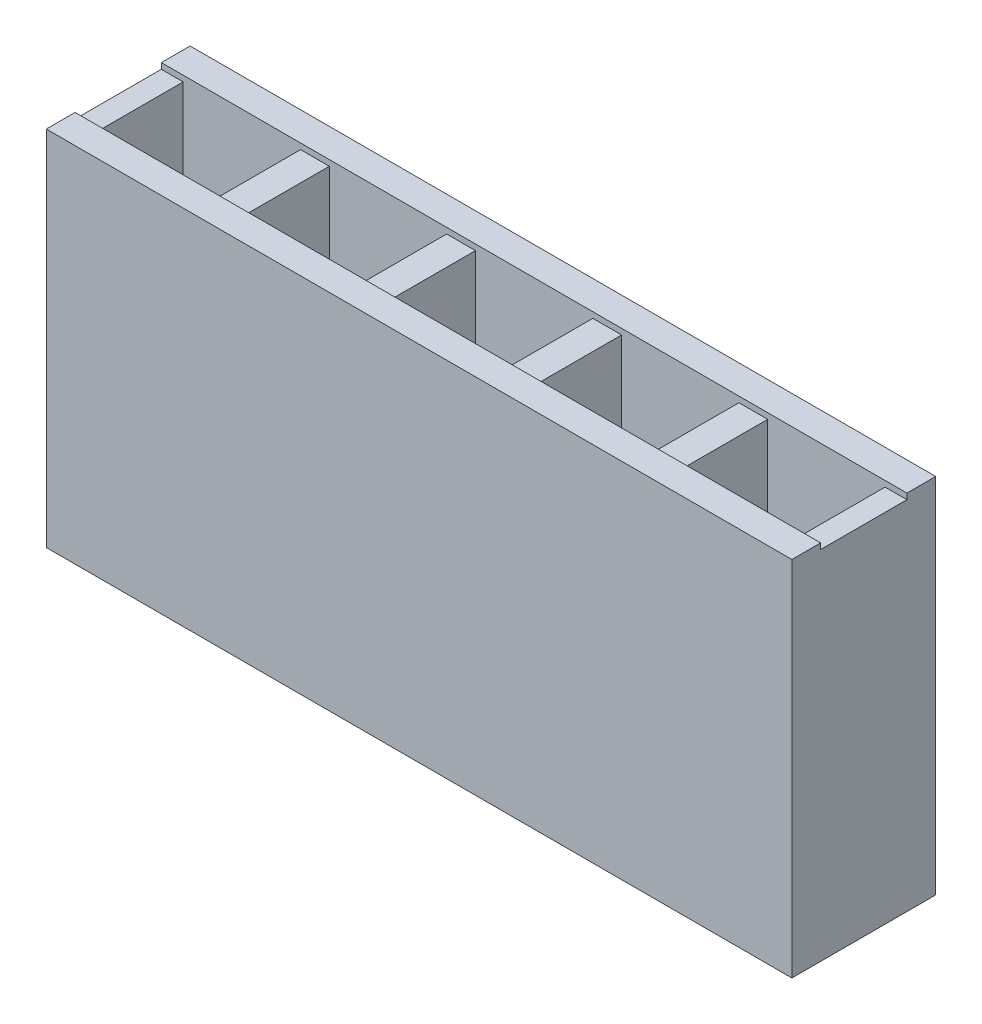
from build123d import *

# Parameters (mm, degrees)
SKETCH1_W                 = 12.96
SKETCH1_H                 = 2.5
BOSS_EXTRUDE1_DEPTH       = 6.2
SKETCH2_W                 = 2.04
SKETCH2_H                 = 1.5
CUT_EXTRUDE1_DEPTH        = 5.75
SKETCH3_W                 = 1.6
SKETCH3_H                 = 1.6
CUT_EXTRUDE2_DEPTH        = 0.45
CUT_EXTRUDE2_DRAFT        = -45
LPATTERN1_COUNT           = 5
LPATTERN1_PITCH           = 2.54
LPATTERN1_COPY_1_SKETCH_W = 1.6
LPATTERN1_COPY_1_SKETCH_H = 1.6
LPATTERN1_COPY_1_DEPTH    = 0.45
LPATTERN1_COPY_1_DRAFT    = -45
LPATTERN1_COPY_2_SKETCH_W = 1.6
LPATTERN1_COPY_2_SKETCH_H = 1.6
LPATTERN1_COPY_2_DEPTH    = 0.45
LPATTERN1_COPY_2_DRAFT    = -45
LPATTERN1_COPY_3_SKETCH_W = 1.6
LPATTERN1_COPY_3_SKETCH_H = 1.6
LPATTERN1_COPY_3_DEPTH    = 0.45
LPATTERN1_COPY_3_DRAFT    = -45
LPATTERN1_COPY_4_SKETCH_W = 1.6
LPATTERN1_COPY_4_SKETCH_H = 1.6
LPATTERN1_COPY_4_DEPTH    = 0.45
LPATTERN1_COPY_4_DRAFT    = -45
SKETCH4_W                 = 12.96
SKETCH4_H                 = 0.5
BOSS_EXTRUDE2_DEPTH       = 0.1


with BuildPart() as part:
    # Sketch1 → Boss-Extrude1 (new body)
    with BuildSketch(Plane(origin=(0, 0, 0), x_dir=(1, 0, 0), z_dir=(0, 1, 0))):
        Rectangle(SKETCH1_W, SKETCH1_H)
    extrude(amount=BOSS_EXTRUDE1_DEPTH)

    # Sketch2 → Cut-Extrude1 (cut)
    with BuildSketch(Plane(origin=(0, 6.2, 0), x_dir=(1, 0, 0), z_dir=(0, 1, 0))):
        with Locations((-5.08, 0)):
            Rectangle(SKETCH2_W, SKETCH2_H)
    cut_extrude1 = extrude(amount=-CUT_EXTRUDE1_DEPTH, mode=Mode.SUBTRACT)


with BuildPart() as cut_extrude2_tool:
    # Sketch3 → Cut-Extrude2 (with draft: the straight prism first)
    with BuildSketch(Plane.XZ):
        with Locations((-5.08, 0)):
            Rectangle(SKETCH3_W, SKETCH3_H)
    extrude(amount=-CUT_EXTRUDE2_DEPTH)
    # Cut-Extrude2: the draft: its side faces are tilted about the plane it starts from
    cut_extrude2_sides = [cut_extrude2_tool.faces().sort_by_distance(p)[0] for p in [
        (-5.08, 0.225, -0.8),
        (-4.28, 0.225, 0),
        (-5.08, 0.225, 0.8),
        (-5.88, 0.225, 0),
    ]]
    draft(cut_extrude2_sides, Plane.XZ, CUT_EXTRUDE2_DRAFT)


with BuildPart() as part_1:
    add(part.part)

    # Cut-Extrude2: cut by cut_extrude2_tool
    add(cut_extrude2_tool.part, mode=Mode.SUBTRACT)

    # LPattern1: Cut-Extrude1 ×5
    with Locations(*[(i * LPATTERN1_PITCH, 0, 0) for i in range(1, LPATTERN1_COUNT)]):
        add(cut_extrude1, mode=Mode.SUBTRACT)


with BuildPart() as lpattern1_copy_1_tool:
    # LPattern1 copy 1 sketch → LPattern1 copy 1 (with draft: the straight prism first)
    with BuildSketch(Plane(origin=(2.54, 0, 0), x_dir=(1, 0, 0), z_dir=(0, -1, 0))):
        with Locations((-5.08, 0)):
            Rectangle(LPATTERN1_COPY_1_SKETCH_W, LPATTERN1_COPY_1_SKETCH_H)
    extrude(amount=-LPATTERN1_COPY_1_DEPTH)
    # LPattern1 copy 1: the draft: its side faces are tilted about the plane it starts from
    lpattern1_copy_1_sides = [lpattern1_copy_1_tool.faces().sort_by_distance(p)[0] for p in [
        (-2.54, 0.225, -0.8),
        (-1.74, 0.225, 0),
        (-2.54, 0.225, 0.8),
        (-3.34, 0.225, 0),
    ]]
    draft(lpattern1_copy_1_sides, Plane(origin=(2.54, 0, 0), x_dir=(1, 0, 0), z_dir=(0, -1, 0)), LPATTERN1_COPY_1_DRAFT)


with BuildPart() as part_2:
    add(part_1.part)

    # LPattern1 copy 1: cut by lpattern1_copy_1_tool
    add(lpattern1_copy_1_tool.part, mode=Mode.SUBTRACT)


with BuildPart() as lpattern1_copy_2_tool:
    # LPattern1 copy 2 sketch → LPattern1 copy 2 (with draft: the straight prism first)
    with BuildSketch(Plane(origin=(5.08, 0, 0), x_dir=(1, 0, 0), z_dir=(0, -1, 0))):
        with Locations((-5.08, 0)):
            Rectangle(LPATTERN1_COPY_2_SKETCH_W, LPATTERN1_COPY_2_SKETCH_H)
    extrude(amount=-LPATTERN1_COPY_2_DEPTH)
    # LPattern1 copy 2: the draft: its side faces are tilted about the plane it starts from
    lpattern1_copy_2_sides = [lpattern1_copy_2_tool.faces().sort_by_distance(p)[0] for p in [
        (0, 0.225, -0.8),
        (0.8, 0.225, 0),
        (0, 0.225, 0.8),
        (-0.8, 0.225, 0),
    ]]
    draft(lpattern1_copy_2_sides, Plane(origin=(5.08, 0, 0), x_dir=(1, 0, 0), z_dir=(0, -1, 0)), LPATTERN1_COPY_2_DRAFT)


with BuildPart() as part_3:
    add(part_2.part)

    # LPattern1 copy 2: cut by lpattern1_copy_2_tool
    add(lpattern1_copy_2_tool.part, mode=Mode.SUBTRACT)


with BuildPart() as lpattern1_copy_3_tool:
    # LPattern1 copy 3 sketch → LPattern1 copy 3 (with draft: the straight prism first)
    with BuildSketch(Plane(origin=(7.62, 0, 0), x_dir=(1, 0, 0), z_dir=(0, -1, 0))):
        with Locations((-5.08, 0)):
            Rectangle(LPATTERN1_COPY_3_SKETCH_W, LPATTERN1_COPY_3_SKETCH_H)
    extrude(amount=-LPATTERN1_COPY_3_DEPTH)
    # LPattern1 copy 3: the draft: its side faces are tilted about the plane it starts from
    lpattern1_copy_3_sides = [lpattern1_copy_3_tool.faces().sort_by_distance(p)[0] for p in [
        (2.54, 0.225, -0.8),
        (3.34, 0.225, 0),
        (2.54, 0.225, 0.8),
        (1.74, 0.225, 0),
    ]]
    draft(lpattern1_copy_3_sides, Plane(origin=(7.62, 0, 0), x_dir=(1, 0, 0), z_dir=(0, -1, 0)), LPATTERN1_COPY_3_DRAFT)


with BuildPart() as part_4:
    add(part_3.part)

    # LPattern1 copy 3: cut by lpattern1_copy_3_tool
    add(lpattern1_copy_3_tool.part, mode=Mode.SUBTRACT)


with BuildPart() as lpattern1_copy_4_tool:
    # LPattern1 copy 4 sketch → LPattern1 copy 4 (with draft: the straight prism first)
    with BuildSketch(Plane(origin=(10.16, 0, 0), x_dir=(1, 0, 0), z_dir=(0, -1, 0))):
        with Locations((-5.08, 0)):
            Rectangle(LPATTERN1_COPY_4_SKETCH_W, LPATTERN1_COPY_4_SKETCH_H)
    extrude(amount=-LPATTERN1_COPY_4_DEPTH)
    # LPattern1 copy 4: the draft: its side faces are tilted about the plane it starts from
    lpattern1_copy_4_sides = [lpattern1_copy_4_tool.faces().sort_by_distance(p)[0] for p in [
        (5.08, 0.225, -0.8),
        (5.88, 0.225, 0),
        (5.08, 0.225, 0.8),
        (4.28, 0.225, 0),
    ]]
    draft(lpattern1_copy_4_sides, Plane(origin=(10.16, 0, 0), x_dir=(1, 0, 0), z_dir=(0, -1, 0)), LPATTERN1_COPY_4_DRAFT)


with BuildPart() as part_5:
    add(part_4.part)

    # LPattern1 copy 4: cut by lpattern1_copy_4_tool
    add(lpattern1_copy_4_tool.part, mode=Mode.SUBTRACT)

    # Sketch4 → Boss-Extrude2 (add)
    with BuildSketch(Plane(origin=(0, 6.2, 0), x_dir=(1, 0, 0), z_dir=(0, 1, 0))):
        with Locations((0, 1)):
            Rectangle(SKETCH4_W, SKETCH4_H)
    boss_extrude2 = extrude(amount=BOSS_EXTRUDE2_DEPTH)

    # Mirror1: Boss-Extrude2 across plane
    add(boss_extrude2.mirror(Plane.XY))


solid = part_5.part
